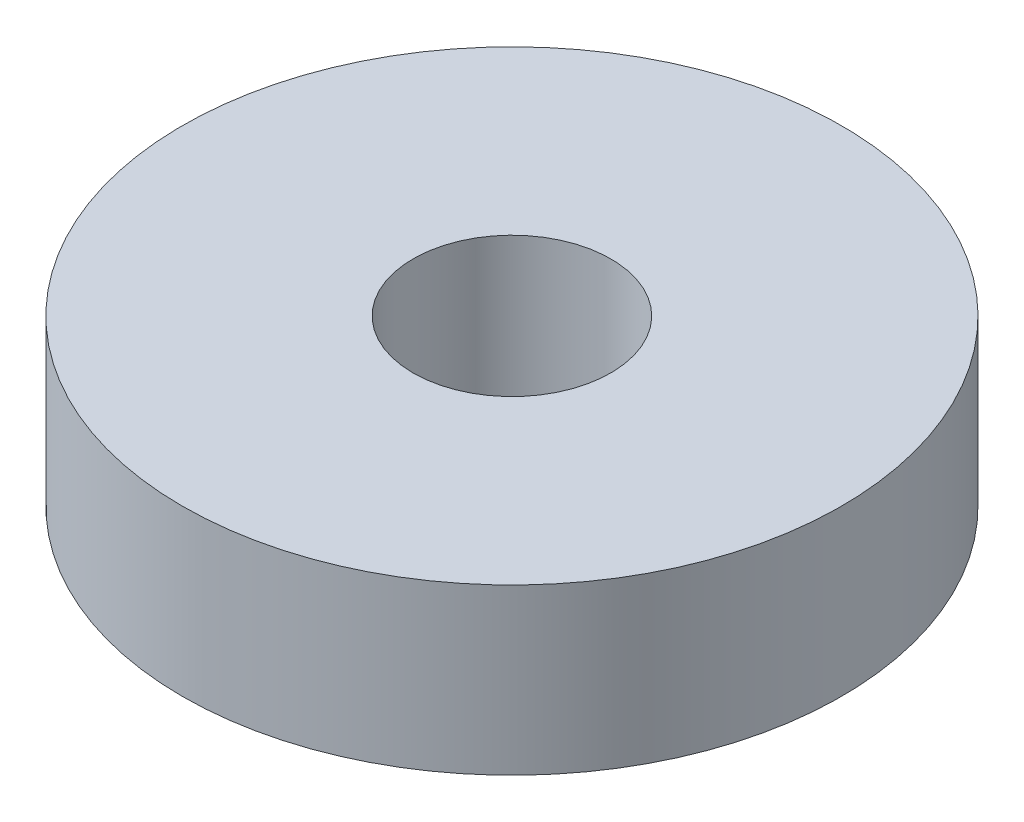
from build123d import *

# Parameters (mm, degrees)
ESBO_O1_R                = 3
RESSALTO_EXTRUS_O1_DEPTH = 5


with BuildPart() as part:
    # Esboço1 → Ressalto-extrusão1 (new body)
    # profile 1 of 2: a face of its own
    with BuildSketch(Plane(origin=(0, 0, 0), x_dir=(1, 0, 0), z_dir=(0, 1, 0))):
        with BuildLine():
            ThreePointArc((0, -10), (7.071067812, -7.071067812), (10, 0))
            ThreePointArc((10, 0), (7.071067812, 7.071067812), (0, 10))
            add(Edge.make_bspline(
                [(0, 10), (-10.337942744, 5.088327064), (-7.360143913, -6.539132188), (0, -10)],
                knots=[0, 0, 0, 0, 1, 1, 1, 1], degree=3))
        make_face()
        with Locations(Location((0, 0, 0), (0, 0, 270))):
            Circle(ESBO_O1_R, mode=Mode.SUBTRACT)
    # profile 2 of 2: a face of its own
    with BuildSketch(Plane(origin=(0, 0, 0), x_dir=(1, 0, 0), z_dir=(0, 1, 0))):
        with BuildLine():
            add(Edge.make_bspline(
                [(0, 10), (-10.337942744, 5.088327064), (-7.360143913, -6.539132188), (0, -10)],
                knots=[0, 0, 0, 0, 1, 1, 1, 1], degree=3))
            ThreePointArc((0, 10), (-10, 0), (0, -10))
        make_face()
    extrude(amount=RESSALTO_EXTRUS_O1_DEPTH)


solid = part.part
